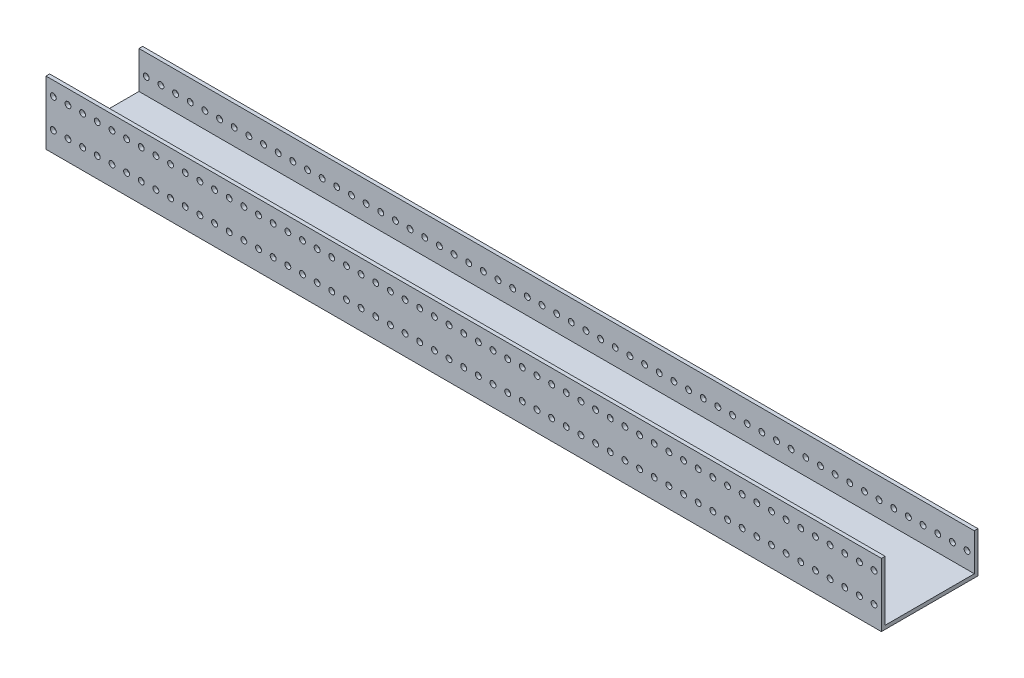
from build123d import *

# Parameters (mm, degrees)
SKETCH1_W           = 723.9
SKETCH1_H           = 83.7184
BOSS_EXTRUDE1_DEPTH = 55.0164
CUT_EXTRUDE1_REACH  = 732.799
SKETCH3_W           = 3.175
SKETCH3_H           = 19.5834
SKETCH6_R           = 2.5527
CUT_EXTRUDE2_DEPTH  = 3.175
CUT_EXTRUDE3_REACH  = 732.799
SKETCH7_R           = 2.5527
LPATTERN1_COUNT     = 57
LPATTERN1_PITCH     = 12.7


with BuildPart() as part:
    # Sketch1 → Boss-Extrude1 (new body)
    with BuildSketch(Plane(origin=(0, 0, 0), x_dir=(1, 0, 0), z_dir=(0, 1, 0))):
        with Locations((361.95, 41.8592)):
            Rectangle(SKETCH1_W, SKETCH1_H)
    extrude(amount=BOSS_EXTRUDE1_DEPTH)

    # Sketch3 → Cut-Extrude1 (cut, up to next)
    with BuildSketch(Plane(origin=(723.9, 0, 0), x_dir=(0, 0, -1), z_dir=(1, 0, 0)), mode=Mode.PRIVATE) as cut_extrude1_sk1:
        Polygon((80.5434, 55.0164), (3.175, 55.0164), (3.175, 3.175), (80.5434, 3.175), (80.5434, 35.433), align=None)
    cut_extrude1_tool1 = extrude(cut_extrude1_sk1.sketch, amount=-CUT_EXTRUDE1_REACH, mode=Mode.PRIVATE) & part.part
    # Sketch3 → Cut-Extrude1 (cut, up to next)
    with BuildSketch(Plane(origin=(723.9, 0, 0), x_dir=(0, 0, -1), z_dir=(1, 0, 0)), mode=Mode.PRIVATE) as cut_extrude1_sk2:
        with Locations((82.1309, 45.2247)):
            Rectangle(SKETCH3_W, SKETCH3_H)
    cut_extrude1_tool2 = extrude(cut_extrude1_sk2.sketch, amount=-CUT_EXTRUDE1_REACH, mode=Mode.PRIVATE) & part.part
    add(cut_extrude1_tool1.solids().sort_by_distance((723.9, 29.0957, -41.8592))[0], mode=Mode.SUBTRACT)
    add(cut_extrude1_tool2.solids().sort_by_distance((723.9, 45.2247, -82.1309))[0], mode=Mode.SUBTRACT)

    # Sketch6 → Cut-Extrude2 (cut)
    with BuildSketch(Plane.XY):
        with Locations((6.35, 42.8244)):
            Circle(SKETCH6_R)
        with Locations((19.05, 42.8244)):
            Circle(SKETCH6_R)
        with Locations((31.75, 42.8244)):
            Circle(SKETCH6_R)
        with Locations((44.45, 42.8244)):
            Circle(SKETCH6_R)
        with Locations((57.15, 42.8244)):
            Circle(SKETCH6_R)
        with Locations((69.85, 42.8244)):
            Circle(SKETCH6_R)
        with Locations((82.55, 42.8244)):
            Circle(SKETCH6_R)
        with Locations((95.25, 42.8244)):
            Circle(SKETCH6_R)
        with Locations((107.95, 42.8244)):
            Circle(SKETCH6_R)
        with Locations((120.65, 42.8244)):
            Circle(SKETCH6_R)
        with Locations((133.35, 42.8244)):
            Circle(SKETCH6_R)
        with Locations((146.05, 42.8244)):
            Circle(SKETCH6_R)
        with Locations((158.75, 42.8244)):
            Circle(SKETCH6_R)
        with Locations((171.45, 42.8244)):
            Circle(SKETCH6_R)
        with Locations((184.15, 42.8244)):
            Circle(SKETCH6_R)
        with Locations((196.85, 42.8244)):
            Circle(SKETCH6_R)
        with Locations((209.55, 42.8244)):
            Circle(SKETCH6_R)
        with Locations((222.25, 42.8244)):
            Circle(SKETCH6_R)
        with Locations((234.95, 42.8244)):
            Circle(SKETCH6_R)
        with Locations((247.65, 42.8244)):
            Circle(SKETCH6_R)
        with Locations((260.35, 42.8244)):
            Circle(SKETCH6_R)
        with Locations((273.05, 42.8244)):
            Circle(SKETCH6_R)
        with Locations((285.75, 42.8244)):
            Circle(SKETCH6_R)
        with Locations((298.45, 42.8244)):
            Circle(SKETCH6_R)
        with Locations((311.15, 42.8244)):
            Circle(SKETCH6_R)
        with Locations((323.85, 42.8244)):
            Circle(SKETCH6_R)
        with Locations((336.55, 42.8244)):
            Circle(SKETCH6_R)
        with Locations((349.25, 42.8244)):
            Circle(SKETCH6_R)
        with Locations((361.95, 42.8244)):
            Circle(SKETCH6_R)
        with Locations((374.65, 42.8244)):
            Circle(SKETCH6_R)
        with Locations((387.35, 42.8244)):
            Circle(SKETCH6_R)
        with Locations((400.05, 42.8244)):
            Circle(SKETCH6_R)
        with Locations((412.75, 42.8244)):
            Circle(SKETCH6_R)
        with Locations((425.45, 42.8244)):
            Circle(SKETCH6_R)
        with Locations((438.15, 42.8244)):
            Circle(SKETCH6_R)
        with Locations((450.85, 42.8244)):
            Circle(SKETCH6_R)
        with Locations((463.55, 42.8244)):
            Circle(SKETCH6_R)
        with Locations((476.25, 42.8244)):
            Circle(SKETCH6_R)
        with Locations((488.95, 42.8244)):
            Circle(SKETCH6_R)
        with Locations((501.65, 42.8244)):
            Circle(SKETCH6_R)
        with Locations((514.35, 42.8244)):
            Circle(SKETCH6_R)
        with Locations((527.05, 42.8244)):
            Circle(SKETCH6_R)
        with Locations((539.75, 42.8244)):
            Circle(SKETCH6_R)
        with Locations((552.45, 42.8244)):
            Circle(SKETCH6_R)
        with Locations((565.15, 42.8244)):
            Circle(SKETCH6_R)
        with Locations((577.85, 42.8244)):
            Circle(SKETCH6_R)
        with Locations((590.55, 42.8244)):
            Circle(SKETCH6_R)
        with Locations((603.25, 42.8244)):
            Circle(SKETCH6_R)
        with Locations((615.95, 42.8244)):
            Circle(SKETCH6_R)
        with Locations((628.65, 42.8244)):
            Circle(SKETCH6_R)
        with Locations((641.35, 42.8244)):
            Circle(SKETCH6_R)
        with Locations((654.05, 42.8244)):
            Circle(SKETCH6_R)
        with Locations((666.75, 42.8244)):
            Circle(SKETCH6_R)
        with Locations((679.45, 42.8244)):
            Circle(SKETCH6_R)
        with Locations((692.15, 42.8244)):
            Circle(SKETCH6_R)
        with Locations((704.85, 42.8244)):
            Circle(SKETCH6_R)
        with Locations((717.55, 42.8244)):
            Circle(SKETCH6_R)
        with Locations((19.05, 17.4244)):
            Circle(SKETCH6_R)
        with Locations((31.75, 17.4244)):
            Circle(SKETCH6_R)
        with Locations((44.45, 17.4244)):
            Circle(SKETCH6_R)
        with Locations((57.15, 17.4244)):
            Circle(SKETCH6_R)
        with Locations((69.85, 17.4244)):
            Circle(SKETCH6_R)
        with Locations((82.55, 17.4244)):
            Circle(SKETCH6_R)
        with Locations((95.25, 17.4244)):
            Circle(SKETCH6_R)
        with Locations((107.95, 17.4244)):
            Circle(SKETCH6_R)
        with Locations((120.65, 17.4244)):
            Circle(SKETCH6_R)
        with Locations((133.35, 17.4244)):
            Circle(SKETCH6_R)
        with Locations((146.05, 17.4244)):
            Circle(SKETCH6_R)
        with Locations((158.75, 17.4244)):
            Circle(SKETCH6_R)
        with Locations((171.45, 17.4244)):
            Circle(SKETCH6_R)
        with Locations((184.15, 17.4244)):
            Circle(SKETCH6_R)
        with Locations((196.85, 17.4244)):
            Circle(SKETCH6_R)
        with Locations((209.55, 17.4244)):
            Circle(SKETCH6_R)
        with Locations((222.25, 17.4244)):
            Circle(SKETCH6_R)
        with Locations((234.95, 17.4244)):
            Circle(SKETCH6_R)
        with Locations((247.65, 17.4244)):
            Circle(SKETCH6_R)
        with Locations((260.35, 17.4244)):
            Circle(SKETCH6_R)
        with Locations((273.05, 17.4244)):
            Circle(SKETCH6_R)
        with Locations((285.75, 17.4244)):
            Circle(SKETCH6_R)
        with Locations((298.45, 17.4244)):
            Circle(SKETCH6_R)
        with Locations((311.15, 17.4244)):
            Circle(SKETCH6_R)
        with Locations((323.85, 17.4244)):
            Circle(SKETCH6_R)
        with Locations((336.55, 17.4244)):
            Circle(SKETCH6_R)
        with Locations((349.25, 17.4244)):
            Circle(SKETCH6_R)
        with Locations((361.95, 17.4244)):
            Circle(SKETCH6_R)
        with Locations((374.65, 17.4244)):
            Circle(SKETCH6_R)
        with Locations((387.35, 17.4244)):
            Circle(SKETCH6_R)
        with Locations((400.05, 17.4244)):
            Circle(SKETCH6_R)
        with Locations((412.75, 17.4244)):
            Circle(SKETCH6_R)
        with Locations((425.45, 17.4244)):
            Circle(SKETCH6_R)
        with Locations((438.15, 17.4244)):
            Circle(SKETCH6_R)
        with Locations((450.85, 17.4244)):
            Circle(SKETCH6_R)
        with Locations((463.55, 17.4244)):
            Circle(SKETCH6_R)
        with Locations((476.25, 17.4244)):
            Circle(SKETCH6_R)
        with Locations((488.95, 17.4244)):
            Circle(SKETCH6_R)
        with Locations((501.65, 17.4244)):
            Circle(SKETCH6_R)
        with Locations((514.35, 17.4244)):
            Circle(SKETCH6_R)
        with Locations((527.05, 17.4244)):
            Circle(SKETCH6_R)
        with Locations((539.75, 17.4244)):
            Circle(SKETCH6_R)
        with Locations((552.45, 17.4244)):
            Circle(SKETCH6_R)
        with Locations((565.15, 17.4244)):
            Circle(SKETCH6_R)
        with Locations((577.85, 17.4244)):
            Circle(SKETCH6_R)
        with Locations((590.55, 17.4244)):
            Circle(SKETCH6_R)
        with Locations((603.25, 17.4244)):
            Circle(SKETCH6_R)
        with Locations((615.95, 17.4244)):
            Circle(SKETCH6_R)
        with Locations((628.65, 17.4244)):
            Circle(SKETCH6_R)
        with Locations((641.35, 17.4244)):
            Circle(SKETCH6_R)
        with Locations((654.05, 17.4244)):
            Circle(SKETCH6_R)
        with Locations((666.75, 17.4244)):
            Circle(SKETCH6_R)
        with Locations((679.45, 17.4244)):
            Circle(SKETCH6_R)
        with Locations((692.15, 17.4244)):
            Circle(SKETCH6_R)
        with Locations((704.85, 17.4244)):
            Circle(SKETCH6_R)
        with Locations((717.55, 17.4244)):
            Circle(SKETCH6_R)
        with Locations((6.35, 17.4244)):
            Circle(SKETCH6_R)
    extrude(amount=-CUT_EXTRUDE2_DEPTH, mode=Mode.SUBTRACT)

    # Sketch7 → Cut-Extrude3 (cut, up to next)
    with BuildSketch(Plane(origin=(0, 0, -83.7184), x_dir=(-1, 0, 0), z_dir=(0, 0, -1)), mode=Mode.PRIVATE) as cut_extrude3_sk1:
        with Locations(Location((-717.55, 17.4244, 0), (0, 0, 180))):
            Circle(SKETCH7_R)
    cut_extrude3_tool1 = extrude(cut_extrude3_sk1.sketch, amount=-CUT_EXTRUDE3_REACH, mode=Mode.PRIVATE) & part.part
    cut_extrude3 = cut_extrude3_tool1.solids().sort_by_distance((717.55, 17.4244, -83.7184))[0]
    add(cut_extrude3, mode=Mode.SUBTRACT)

    # LPattern1: Cut-Extrude3 ×57
    with Locations(*[(-i * LPATTERN1_PITCH, 0, 0) for i in range(1, LPATTERN1_COUNT)]):
        add(cut_extrude3, mode=Mode.SUBTRACT)


solid = part.part
